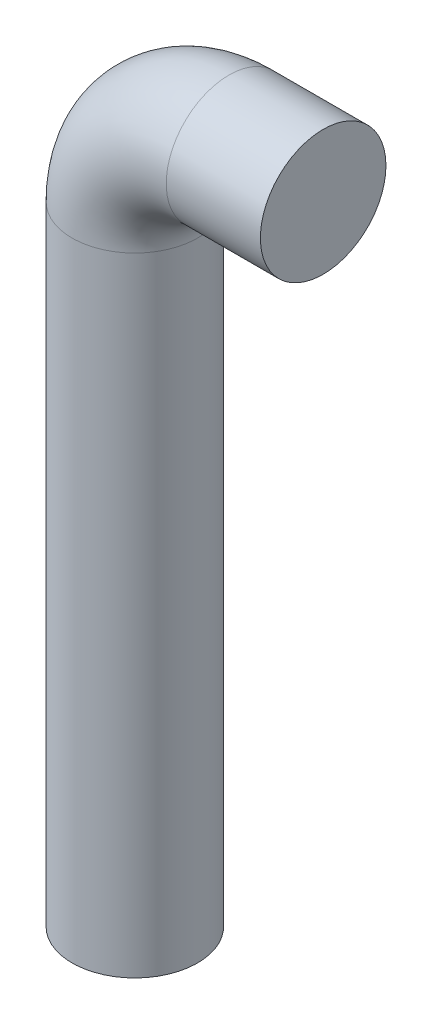
from build123d import *

# Parameters (mm, degrees)
SKETCH2_R = 2


with BuildPart() as part:
    # Sweep1: sweep along a path in Sketch1
    with BuildLine(Plane.XY) as sweep1_path:
        Line((0, 0), (-3, 0))
        ThreePointArc((-3, 0), (-5.121320344, -0.878679656), (-6, -3))
        Line((-6, -3), (-6, -23))
    # Sketch2 → Sweep1 (sweep)
    with BuildSketch(Plane(origin=(0, 0, 0), x_dir=(0, 0, -1), z_dir=(1, 0, 0))):
        Circle(SKETCH2_R)
    sweep(path=sweep1_path.line)


solid = part.part
